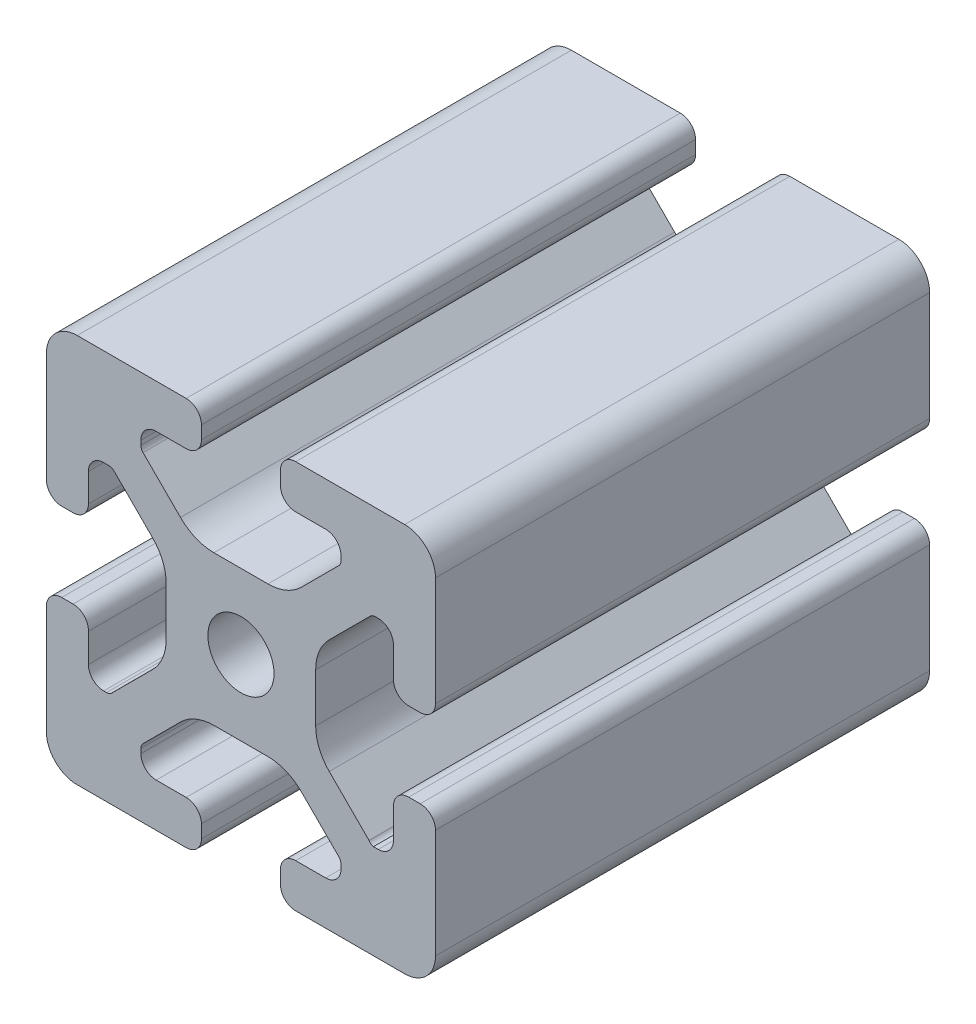
from build123d import *

# Parameters (mm, degrees)
SKETCH1_R             = 3.4
EXTRUDE1_DEPTH        = 50.8
F_8_0MM_DOWEL_HOLE1_D = 8


with BuildPart() as part:
    # Sketch1 → Extrude1 (new body)
    with BuildSketch(Plane.XY):
        with BuildLine():
            Line((-8.715, -15.524615034), (-5.63, -15.524615034))
            ThreePointArc((-5.63, -15.524615034), (-4.519842354, -15.984457388), (-4.06, -17.094615034))
            Line((-4.06, -17.094615034), (-4.06, -18.43))
            ThreePointArc((-4.06, -18.43), (-4.519842354, -19.540157646), (-5.63, -20))
            Line((-5.63, -20), (-16.674615034, -20))
            ThreePointArc((-16.674615034, -20), (-18.951578385, -19.194274381), (-20, -17.018368134))
            Line((-20, -17.018368134), (-20, -5.757918808))
            ThreePointArc((-20, -5.757918808), (-19.564709668, -4.603883664), (-18.43, -4.120449326))
            Line((-18.43, -4.120449326), (-17.25, -4.120449326))
            ThreePointArc((-17.25, -4.120449326), (-16.115287682, -4.60388249), (-15.67999625, -5.757919334))
            Line((-15.67999625, -5.757919334), (-15.67999625, -8.715399492))
            ThreePointArc((-15.67999625, -8.715399492), (-15.220153896, -9.825557139), (-14.10999625, -10.285399492))
            Line((-14.10999625, -10.285399492), (-13.816898819, -10.285399492))
            ThreePointArc((-13.816898819, -10.285399492), (-13.526061711, -10.227547119), (-13.279501941, -10.062800646))
            Line((-13.279501941, -10.062800646), (-9.076242789, -5.859541495))
            ThreePointArc((-9.076242789, -5.859541495), (-8.046572221, -4.318530588), (-7.685, -2.500784284))
            Line((-7.685, -2.500784284), (-7.685, 2.500784284))
            ThreePointArc((-7.685, 2.500784284), (-8.046572221, 4.318530588), (-9.076242789, 5.859541495))
            Line((-9.076242789, 5.859541495), (-13.040489136, 9.823787841))
            ThreePointArc((-13.040489136, 9.823787841), (-13.354224618, 10.012729352), (-13.71989919, 10.033001362))
            Line((-13.71989919, 10.033001362), (-14.05520779, 10.044710596))
            ThreePointArc((-14.05520779, 10.044710596), (-15.200613642, 9.605030484), (-15.68, 8.475666998))
            Line((-15.68, 8.475666998), (-15.68, 5.572979049))
            ThreePointArc((-15.68, 5.572979049), (-16.139842354, 4.462821403), (-17.25, 4.002979049))
            Line((-17.25, 4.002979049), (-18.43, 4.002979049))
            ThreePointArc((-18.43, 4.002979049), (-19.540157646, 4.462821403), (-20, 5.572979049))
            Line((-20, 5.572979049), (-20, 13.004526564))
            Line((-20, 13.004526564), (-20, 16.83))
            ThreePointArc((-20, 16.83), (-19.071528496, 19.071528496), (-16.83, 20))
            Line((-16.83, 20), (-5.63, 20))
            ThreePointArc((-5.63, 20), (-4.519842354, 19.540157646), (-4.06, 18.43))
            Line((-4.06, 18.43), (-4.06, 17.094615034))
            ThreePointArc((-4.06, 17.094615034), (-4.519842354, 15.984457388), (-5.63, 15.524615034))
            Line((-5.63, 15.524615034), (-8.715, 15.524615034))
            ThreePointArc((-8.715, 15.524615034), (-9.825157646, 15.06477268), (-10.285, 13.954615034))
            Line((-10.285, 13.954615034), (-10.285, 13.492503602))
            ThreePointArc((-10.285, 13.492503602), (-10.227148445, 13.201664194), (-10.062401154, 12.955102448))
            Line((-10.062401154, 12.955102448), (-6.217092793, 9.109794088))
            ThreePointArc((-6.217092793, 9.109794088), (-4.63891877, 8.055291919), (-2.777335583, 7.685))
            Line((-2.777335583, 7.685), (2.777335583, 7.685))
            ThreePointArc((2.777335583, 7.685), (4.63891877, 8.055291919), (6.217092793, 9.109794088))
            Line((6.217092793, 9.109794088), (10.062401154, 12.955102448))
            ThreePointArc((10.062401154, 12.955102448), (10.227148445, 13.201664194), (10.285, 13.492503602))
            Line((10.285, 13.492503602), (10.285, 13.954615034))
            ThreePointArc((10.285, 13.954615034), (9.825157646, 15.06477268), (8.715, 15.524615034))
            Line((8.715, 15.524615034), (5.63, 15.524615034))
            ThreePointArc((5.63, 15.524615034), (4.519842354, 15.984457388), (4.06, 17.094615034))
            Line((4.06, 17.094615034), (4.06, 18.43))
            ThreePointArc((4.06, 18.43), (4.519842354, 19.540157646), (5.63, 20))
            Line((5.63, 20), (12.979635074, 20))
            Line((12.979635074, 20), (16.83, 20))
            ThreePointArc((16.83, 20), (19.071528496, 19.071528496), (20, 16.83))
            Line((20, 16.83), (20, 13.001098436))
            Line((20, 13.001098436), (20, 5.63))
            ThreePointArc((20, 5.63), (19.540157461, 4.519842693), (18.43, 4.060000526))
            Line((18.43, 4.060000526), (17.24999625, 4.060000526))
            ThreePointArc((17.24999625, 4.060000526), (16.139838603, 4.519842879), (15.67999625, 5.630000526))
            Line((15.67999625, 5.630000526), (15.67999625, 8.715399492))
            ThreePointArc((15.67999625, 8.715399492), (15.220153896, 9.825557139), (14.10999625, 10.285399492))
            Line((14.10999625, 10.285399492), (13.816903094, 10.285399492))
            ThreePointArc((13.816903094, 10.285399492), (13.526063686, 10.227547937), (13.279501941, 10.062800646))
            Line((13.279501941, 10.062800646), (9.076242789, 5.859541495))
            ThreePointArc((9.076242789, 5.859541495), (8.046572221, 4.318530588), (7.685, 2.500784284))
            Line((7.685, 2.500784284), (7.685, -2.500784284))
            ThreePointArc((7.685, -2.500784284), (8.046572221, -4.318530588), (9.076242789, -5.859541495))
            Line((9.076242789, -5.859541495), (13.163657296, -9.946956002))
            ThreePointArc((13.163657296, -9.946956002), (13.35903797, -10.160433474), (13.6200547, -10.285399492))
            Line((13.6200547, -10.285399492), (14.10999625, -10.285399492))
            ThreePointArc((14.10999625, -10.285399492), (15.220153896, -9.825557139), (15.67999625, -8.715399492))
            Line((15.67999625, -8.715399492), (15.67999625, -5.630000526))
            ThreePointArc((15.67999625, -5.630000526), (16.139838603, -4.519842879), (17.24999625, -4.060000526))
            Line((17.24999625, -4.060000526), (18.43, -4.060000526))
            ThreePointArc((18.43, -4.060000526), (19.540157461, -4.519842693), (20, -5.63))
            Line((20, -5.63), (20, -16.83))
            ThreePointArc((20, -16.83), (19.071528496, -19.071528496), (16.83, -20))
            Line((16.83, -20), (13, -20))
            Line((13, -20), (5.63, -20))
            ThreePointArc((5.63, -20), (4.519842354, -19.540157646), (4.06, -18.43))
            Line((4.06, -18.43), (4.06, -17.094615034))
            ThreePointArc((4.06, -17.094615034), (4.519842354, -15.984457388), (5.63, -15.524615034))
            Line((5.63, -15.524615034), (8.715, -15.524615034))
            ThreePointArc((8.715, -15.524615034), (9.825157646, -15.06477268), (10.285, -13.954615034))
            Line((10.285, -13.954615034), (10.285, -13.492503602))
            ThreePointArc((10.285, -13.492503602), (10.227148445, -13.201664194), (10.062401154, -12.955102448))
            Line((10.062401154, -12.955102448), (6.217092793, -9.109794088))
            ThreePointArc((6.217092793, -9.109794088), (4.63891877, -8.055291919), (2.777335583, -7.685))
            Line((2.777335583, -7.685), (-2.777335583, -7.685))
            ThreePointArc((-2.777335583, -7.685), (-4.63891877, -8.055291919), (-6.217092793, -9.109794088))
            Line((-6.217092793, -9.109794088), (-10.062401154, -12.955102448))
            ThreePointArc((-10.062401154, -12.955102448), (-10.227148445, -13.201664194), (-10.285, -13.492503602))
            Line((-10.285, -13.492503602), (-10.285, -13.954615034))
            ThreePointArc((-10.285, -13.954615034), (-9.825157646, -15.06477268), (-8.715, -15.524615034))
        make_face()
        Circle(SKETCH1_R, mode=Mode.SUBTRACT)
    extrude(amount=-EXTRUDE1_DEPTH)

    # Ø8.0mm Dowel Hole1 (through all)
    with Locations(Plane(origin=(0, -20, 0), x_dir=(-1, 0, 0), z_dir=(0, -1, 0))):
        with Locations((0, 15.6), (0, 35.2)):
            Hole(F_8_0MM_DOWEL_HOLE1_D / 2)


solid = part.part
